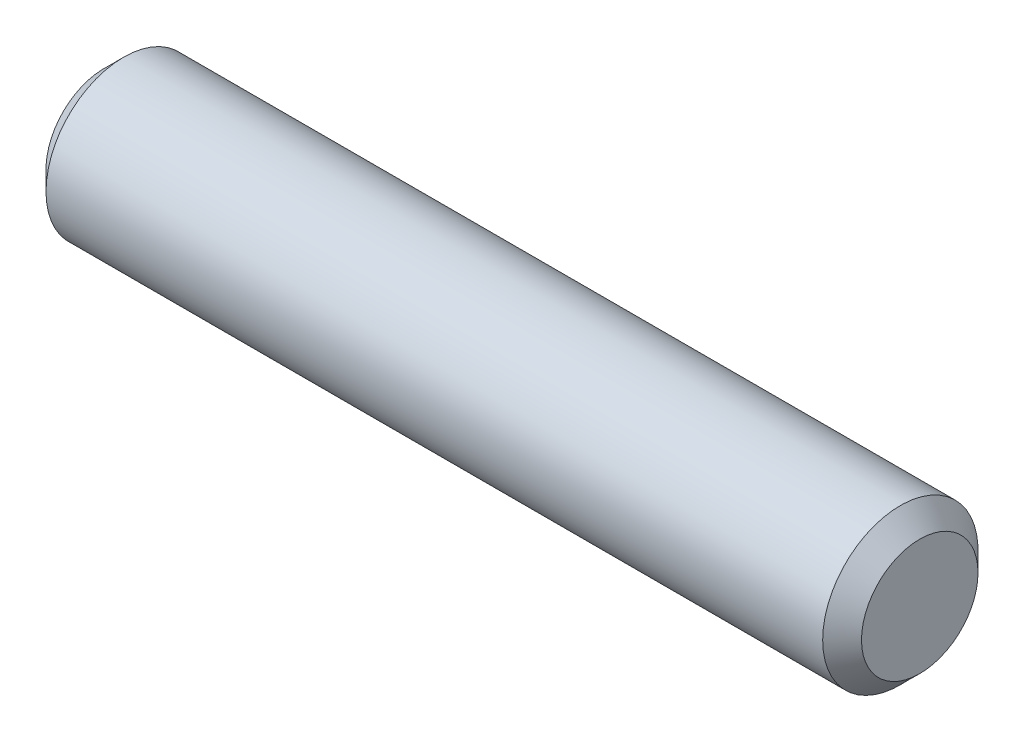
from build123d import *

# Parameters (mm, degrees)
ESQUISSE1_R        = 2
BOSS_EXTRU_1_DEPTH = 10.5
CHANFREIN1_SIZE    = 0.5


with BuildPart() as part:
    # Esquisse1 → Boss.-Extru.1 (new, symmetric)
    with BuildSketch(Plane(origin=(0, 0, 0), x_dir=(0, 0, -1), z_dir=(1, 0, 0))):
        with Locations(Location((0, 0, 0), (0, 0, 180))):
            Circle(ESQUISSE1_R)
    extrude(amount=BOSS_EXTRU_1_DEPTH, both=True)

    # Chanfrein1
    chanfrein1_edges = [part.edges().sort_by_distance(p)[0] for p in [
        (-10.5, 0, -2),
        (10.5, 0, -2),
    ]]
    chamfer(chanfrein1_edges, length=CHANFREIN1_SIZE)


solid = part.part
